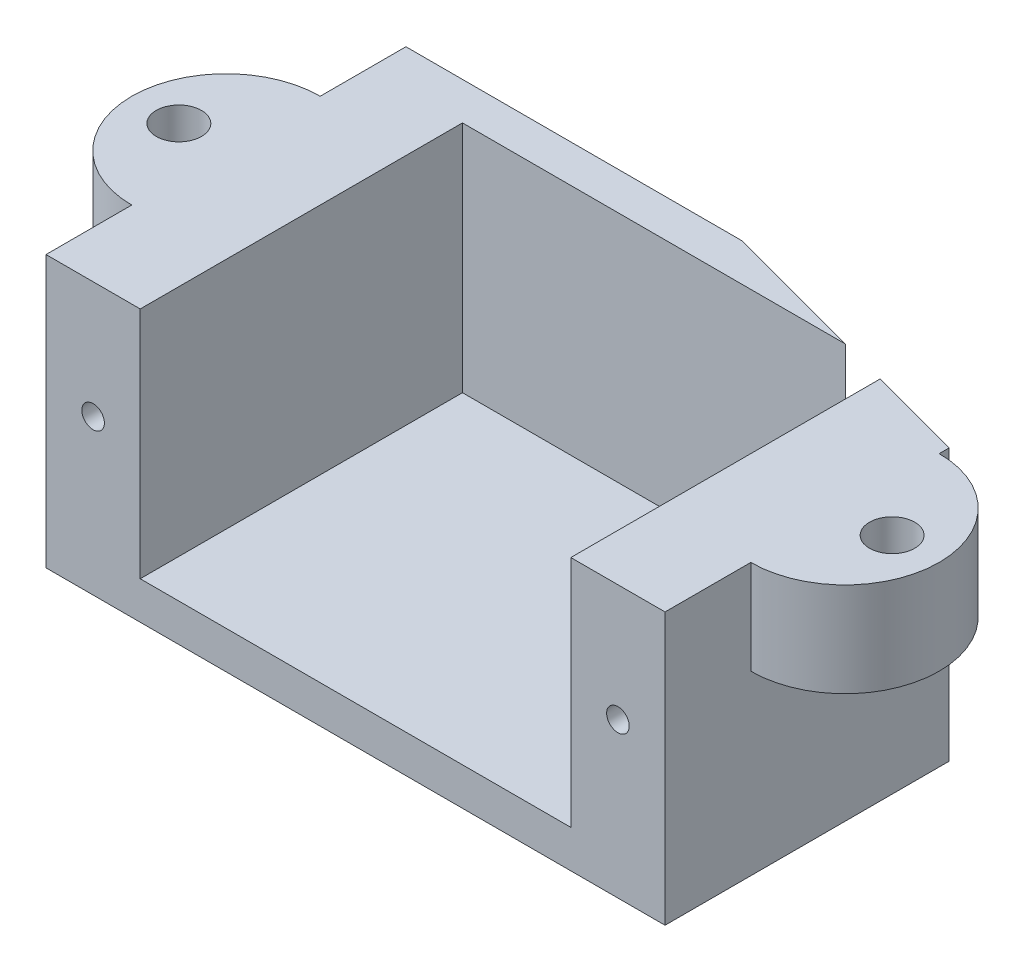
from build123d import *

# Parameters (mm, degrees)
SCHIZZO1_W                   = 32.85
SCHIZZO1_H                   = 16.4
SCHIZZO1_W_2                 = 22.85
SCHIZZO1_H_2                 = 12.4
ESTRUSIONE_ESTRUSIONE1_DEPTH = 17.1
SCHIZZO2_W                   = 32.85
SCHIZZO2_H                   = 16.4
ESTRUSIONE_ESTRUSIONE2_DEPTH = 2
TAGLIO_ESTRUSIONE1_DEPTH     = 29.829683054
TAGLIO_ESTRUSIONE2_REACH     = 28.492
SCHIZZO16_W                  = 32.85
SCHIZZO16_H                  = 2
ESTRUSIONE_ESTRUSIONE3_DEPTH = 5


with BuildPart() as part:
    # Schizzo1 → Estrusione-Estrusione1 (new body)
    with BuildSketch(Plane.XY):
        Rectangle(SCHIZZO1_W, SCHIZZO1_H)
        Rectangle(SCHIZZO1_W_2, SCHIZZO1_H_2, mode=Mode.SUBTRACT)
    extrude(amount=ESTRUSIONE_ESTRUSIONE1_DEPTH)

    # Schizzo2 → Estrusione-Estrusione2 (add)
    with BuildSketch(Plane(origin=(0, 0, 0), x_dir=(-1, 0, 0), z_dir=(0, 0, -1))):
        Rectangle(SCHIZZO2_W, SCHIZZO2_H)
    extrude(amount=ESTRUSIONE_ESTRUSIONE2_DEPTH)

    # Schizzo8 → Foro per Vite M1-1 (revolve, cut)
    with BuildSketch(Plane(origin=(-13.925, 0, 17.1), x_dir=(0, -1, 0), z_dir=(1, 0, 0))):
        Polygon((0, 0), (0, 10.360516371), (0.6, 10), (0.6, 0), align=None)
    foro_per_vite_m1_1 = revolve(axis=Axis((-13.925, 0, 23.45), (0, 0, -1)), mode=Mode.SUBTRACT)

    # Specchia1: Foro per Vite M1-1 across plane
    add(foro_per_vite_m1_1.mirror(Plane(origin=(0, 0, 0), x_dir=(0, 0, 1), z_dir=(1, 0, 0))), mode=Mode.SUBTRACT)

    # Schizzo15 → Taglio-Estrusione1 (cut, through all)
    with BuildSketch(Plane.XZ.offset(8.2)):
        Polygon((16.425, -2), (1.425, -2), (16.425, 2.019237886), align=None)
    extrude(amount=-TAGLIO_ESTRUSIONE1_DEPTH, mode=Mode.SUBTRACT)

    # Schizzo16 → Taglio-Estrusione2 (cut, up to next)
    with BuildSketch(Plane.XY.offset(17.1), mode=Mode.PRIVATE) as taglio_estrusione2_sk1:
        with Locations((0, 7.2)):
            Rectangle(SCHIZZO16_W, SCHIZZO16_H)
    taglio_estrusione2_tool1 = extrude(taglio_estrusione2_sk1.sketch, amount=-TAGLIO_ESTRUSIONE2_REACH, mode=Mode.PRIVATE) & part.part
    add(taglio_estrusione2_tool1.solids().sort_by_distance((0, 7.2, 17.1))[0], mode=Mode.SUBTRACT)

    # Schizzo17 → Estrusione-Estrusione3 (add)
    with BuildSketch(Plane(origin=(0, 6.2, 0), x_dir=(1, 0, 0), z_dir=(0, 1, 0))):
        with BuildLine():
            Line((-16.425, -2.55), (-16.425, -12.55))
            ThreePointArc((-16.425, -12.55), (-21.425, -7.55), (-16.425, -2.55))
        make_face()
    estrusione_estrusione3 = extrude(amount=-ESTRUSIONE_ESTRUSIONE3_DEPTH)

    # Schizzo20 → Foro per Vite M2-1 (revolve, cut)
    with BuildSketch(Plane(origin=(-18.925, 1.2, 7.55), x_dir=(0, 0, -1), z_dir=(1, 0, 0))):
        Polygon((0, 0), (0, 10.721032743), (1.2, 10), (1.2, 0), align=None)
    foro_per_vite_m2_1 = revolve(axis=Axis((-18.925, -5.15, 7.55), (0, 1, 0)), mode=Mode.SUBTRACT)

    # Specchia2: Estrusione-Estrusione3, Foro per Vite M2-1 across plane
    add(estrusione_estrusione3.mirror(Plane(origin=(0, 0, 0), x_dir=(0, 0, 1), z_dir=(1, 0, 0))))
    add(foro_per_vite_m2_1.mirror(Plane(origin=(0, 0, 0), x_dir=(0, 0, 1), z_dir=(1, 0, 0))), mode=Mode.SUBTRACT)


solid = part.part
